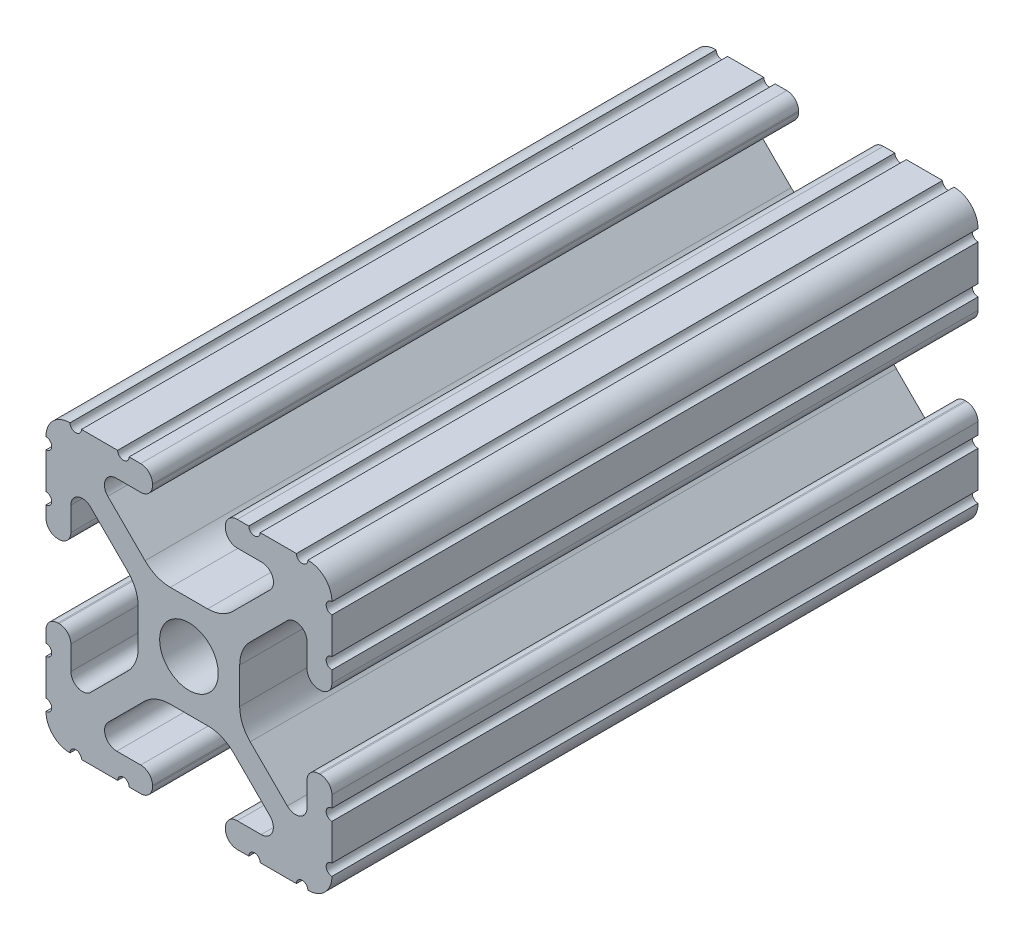
from build123d import *

# Parameters (mm, degrees)
SKETCH1_R           = 2.6035
BOSS_EXTRUDE1_DEPTH = 152.4
SKETCH2_R           = 23.941884012
CUT_EXTRUDE1_DEPTH  = 247.396


with BuildPart() as part:
    # Sketch1 → Boss-Extrude1 (new, symmetric)
    with BuildSketch(Plane.XY):
        with BuildLine():
            Line((-7.179650497, -8.645192506), (-3.952270251, -5.423690499))
            ThreePointArc((-3.952270251, -5.423690499), (-2.922936451, -4.736929036), (-1.709253557, -4.4958))
            Line((-1.709253557, -4.4958), (1.709253557, -4.4958))
            ThreePointArc((1.709253557, -4.4958), (2.922936451, -4.736929036), (3.952270251, -5.423690499))
            Line((3.952270251, -5.423690499), (7.179650497, -8.645192506))
            ThreePointArc((7.179650497, -8.645192506), (7.41473083, -9.822813117), (6.416408329, -10.4902))
            Line((6.416408329, -10.4902), (4.287512407, -10.4902))
            ThreePointArc((4.287512407, -10.4902), (3.54574862, -10.79744862), (3.2385, -11.539212407))
            Line((3.2385, -11.539212407), (3.2385, -11.650987593))
            ThreePointArc((3.2385, -11.650987593), (3.54574862, -12.39275138), (4.287512407, -12.7))
            Line((4.287512407, -12.7), (5.317126718, -12.7))
            ThreePointArc((5.317126718, -12.7), (5.825126718, -12.192), (6.333126718, -12.7))
            Line((6.333126718, -12.7), (9.550443118, -12.7))
            ThreePointArc((9.550443118, -12.7), (10.058366869, -12.192000006), (10.566443095, -12.699847501))
            ThreePointArc((10.566443095, -12.699847501), (12.082537762, -12.08250727), (12.699846982, -10.566399977))
            ThreePointArc((12.699846982, -10.566399977), (12.192000006, -10.058323491), (12.7, -9.5504))
            Line((12.7, -9.5504), (12.7, -6.3330836))
            ThreePointArc((12.7, -6.3330836), (12.192, -5.8250836), (12.7, -5.3170836))
            Line((12.7, -5.3170836), (12.7, -4.287469289))
            ThreePointArc((12.7, -4.287469289), (12.39275138, -3.545705502), (11.650987593, -3.238456882))
            Line((11.650987593, -3.238456882), (11.539212407, -3.238456882))
            ThreePointArc((11.539212407, -3.238456882), (10.79744862, -3.545705502), (10.4902, -4.287469289))
            Line((10.4902, -4.287469289), (10.4902, -6.402089023))
            ThreePointArc((10.4902, -6.402089023), (9.856505071, -7.351067942), (8.737131347, -7.129408934))
            Line((8.737131347, -7.129408934), (5.441005833, -3.840816462))
            ThreePointArc((5.441005833, -3.840816462), (4.750877967, -2.809883091), (4.5085, -1.593185507))
            Line((4.5085, -1.593185507), (4.5085, 1.593185507))
            ThreePointArc((4.5085, 1.593185507), (4.750877967, 2.809883091), (5.441005833, 3.840816462))
            Line((5.441005833, 3.840816462), (8.737131347, 7.129408934))
            ThreePointArc((8.737131347, 7.129408934), (9.856505071, 7.351067942), (10.4902, 6.402089023))
            Line((10.4902, 6.402089023), (10.4902, 4.287469289))
            ThreePointArc((10.4902, 4.287469289), (10.79744862, 3.545705502), (11.539212407, 3.238456882))
            Line((11.539212407, 3.238456882), (11.650987593, 3.238456882))
            ThreePointArc((11.650987593, 3.238456882), (12.39275138, 3.545705502), (12.7, 4.287469289))
            Line((12.7, 4.287469289), (12.7, 5.3170836))
            ThreePointArc((12.7, 5.3170836), (12.192, 5.8250836), (12.7, 6.3330836))
            Line((12.7, 6.3330836), (12.7, 9.5504))
            ThreePointArc((12.7, 9.5504), (12.192000006, 10.058323491), (12.699846982, 10.566399977))
            ThreePointArc((12.699846982, 10.566399977), (12.082537762, 12.08250727), (10.566443095, 12.699847501))
            ThreePointArc((10.566443095, 12.699847501), (10.058366869, 12.192000006), (9.550443118, 12.7))
            Line((9.550443118, 12.7), (6.333126718, 12.7))
            ThreePointArc((6.333126718, 12.7), (5.825126718, 12.192), (5.317126718, 12.7))
            Line((5.317126718, 12.7), (4.287512407, 12.7))
            ThreePointArc((4.287512407, 12.7), (3.54574862, 12.39275138), (3.2385, 11.650987593))
            Line((3.2385, 11.650987593), (3.2385, 11.539212407))
            ThreePointArc((3.2385, 11.539212407), (3.54574862, 10.79744862), (4.287512407, 10.4902))
            Line((4.287512407, 10.4902), (6.476788598, 10.4902))
            ThreePointArc((6.476788598, 10.4902), (7.432222385, 9.85140422), (7.207036008, 8.724370562))
            Line((7.207036008, 8.724370562), (3.898272566, 5.423169045))
            ThreePointArc((3.898272566, 5.423169045), (2.869120213, 4.736787962), (1.655778399, 4.4958))
            Line((1.655778399, 4.4958), (-1.655778399, 4.4958))
            ThreePointArc((-1.655778399, 4.4958), (-2.869120213, 4.736787962), (-3.898272566, 5.423169045))
            Line((-3.898272566, 5.423169045), (-7.207036008, 8.724370562))
            ThreePointArc((-7.207036008, 8.724370562), (-7.432222385, 9.85140422), (-6.476788598, 10.4902))
            Line((-6.476788598, 10.4902), (-4.287512407, 10.4902))
            ThreePointArc((-4.287512407, 10.4902), (-3.54574862, 10.79744862), (-3.2385, 11.539212407))
            Line((-3.2385, 11.539212407), (-3.2385, 11.650987593))
            ThreePointArc((-3.2385, 11.650987593), (-3.54574862, 12.39275138), (-4.287512407, 12.7))
            Line((-4.287512407, 12.7), (-5.317126718, 12.7))
            ThreePointArc((-5.317126718, 12.7), (-5.825126718, 12.192), (-6.333126718, 12.7))
            Line((-6.333126718, 12.7), (-9.550443118, 12.7))
            ThreePointArc((-9.550443118, 12.7), (-10.058366869, 12.192000006), (-10.566443095, 12.699847501))
            ThreePointArc((-10.566443095, 12.699847501), (-12.082537762, 12.08250727), (-12.699846982, 10.566399977))
            ThreePointArc((-12.699846982, 10.566399977), (-12.192000006, 10.058323491), (-12.7, 9.5504))
            Line((-12.7, 9.5504), (-12.7, 6.3330836))
            ThreePointArc((-12.7, 6.3330836), (-12.192, 5.8250836), (-12.7, 5.3170836))
            Line((-12.7, 5.3170836), (-12.7, 4.287469289))
            ThreePointArc((-12.7, 4.287469289), (-12.39275138, 3.545705502), (-11.650987593, 3.238456882))
            Line((-11.650987593, 3.238456882), (-11.539212407, 3.238456882))
            ThreePointArc((-11.539212407, 3.238456882), (-10.79744862, 3.545705502), (-10.4902, 4.287469289))
            Line((-10.4902, 4.287469289), (-10.4902, 6.402089023))
            ThreePointArc((-10.4902, 6.402089023), (-9.856505071, 7.351067942), (-8.737131347, 7.129408934))
            Line((-8.737131347, 7.129408934), (-5.441005833, 3.840816462))
            ThreePointArc((-5.441005833, 3.840816462), (-4.750877967, 2.809883091), (-4.5085, 1.593185507))
            Line((-4.5085, 1.593185507), (-4.5085, -1.593185507))
            ThreePointArc((-4.5085, -1.593185507), (-4.750877967, -2.809883091), (-5.441005833, -3.840816462))
            Line((-5.441005833, -3.840816462), (-8.737131347, -7.129408934))
            ThreePointArc((-8.737131347, -7.129408934), (-9.856505071, -7.351067942), (-10.4902, -6.402089023))
            Line((-10.4902, -6.402089023), (-10.4902, -4.287469289))
            ThreePointArc((-10.4902, -4.287469289), (-10.79744862, -3.545705502), (-11.539212407, -3.238456882))
            Line((-11.539212407, -3.238456882), (-11.650987593, -3.238456882))
            ThreePointArc((-11.650987593, -3.238456882), (-12.39275138, -3.545705502), (-12.7, -4.287469289))
            Line((-12.7, -4.287469289), (-12.7, -5.3170836))
            ThreePointArc((-12.7, -5.3170836), (-12.192, -5.8250836), (-12.7, -6.3330836))
            Line((-12.7, -6.3330836), (-12.7, -9.5504))
            ThreePointArc((-12.7, -9.5504), (-12.192000006, -10.058323491), (-12.699846982, -10.566399977))
            ThreePointArc((-12.699846982, -10.566399977), (-12.082537762, -12.08250727), (-10.566443095, -12.699847501))
            ThreePointArc((-10.566443095, -12.699847501), (-10.058366869, -12.192000006), (-9.550443118, -12.7))
            Line((-9.550443118, -12.7), (-6.333126718, -12.7))
            ThreePointArc((-6.333126718, -12.7), (-5.825126718, -12.192), (-5.317126718, -12.7))
            Line((-5.317126718, -12.7), (-4.287512407, -12.7))
            ThreePointArc((-4.287512407, -12.7), (-3.54574862, -12.39275138), (-3.2385, -11.650987593))
            Line((-3.2385, -11.650987593), (-3.2385, -11.539212407))
            ThreePointArc((-3.2385, -11.539212407), (-3.54574862, -10.79744862), (-4.287512407, -10.4902))
            Line((-4.287512407, -10.4902), (-6.416408329, -10.4902))
            ThreePointArc((-6.416408329, -10.4902), (-7.41473083, -9.822813117), (-7.179650497, -8.645192506))
        make_face()
        with Locations(Location((0, 0, 0), (0, 0, 180))):
            Circle(SKETCH1_R, mode=Mode.SUBTRACT)
    extrude(amount=BOSS_EXTRUDE1_DEPTH, both=True)

    # Sketch2 → Cut-Extrude1 (cut)
    with BuildSketch(Plane.XY.offset(152.4)):
        Circle(SKETCH2_R)
    extrude(amount=-CUT_EXTRUDE1_DEPTH, mode=Mode.SUBTRACT)


solid = part.part
